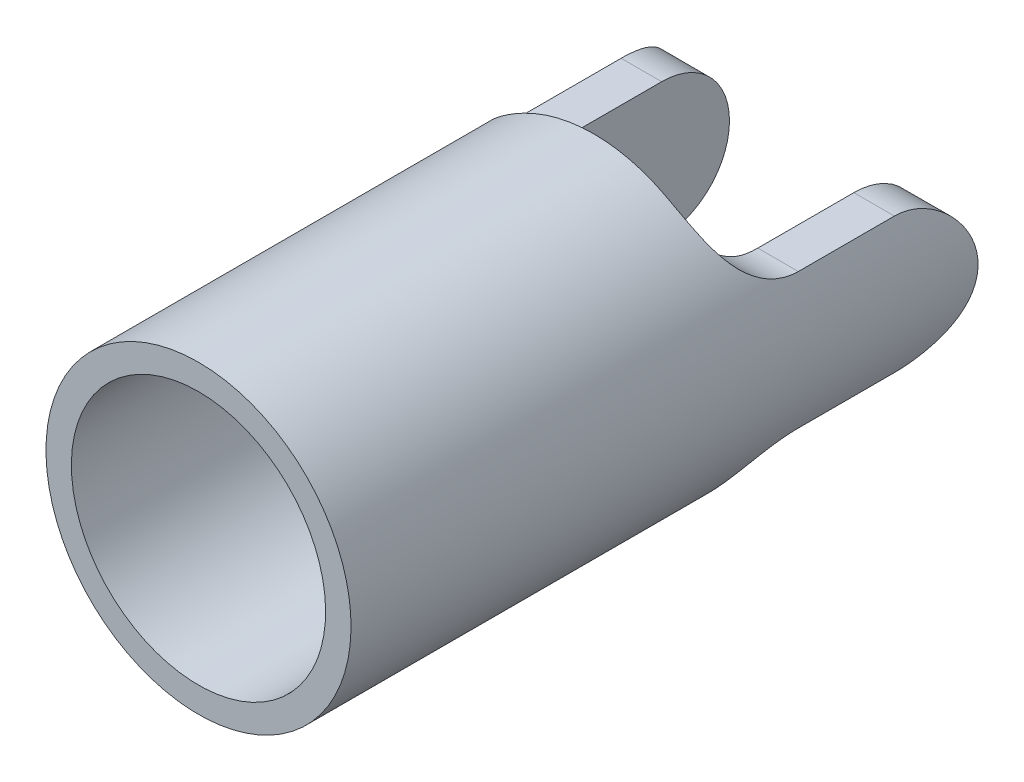
from build123d import *

# Parameters (mm, degrees)
CUT_EXTRUDE1_DEPTH      = 38.432697939
CUT_EXTRUDE1_DEPTH_BACK = 38.432697939
CUT_EXTRUDE2_DEPTH      = 38.432698083
CUT_EXTRUDE2_DEPTH_BACK = 38.432698083


with BuildPart() as part:
    # Sketch1 → Revolve1 (revolve)
    with BuildSketch(Plane(origin=(0, 0, 0), x_dir=(0, 0, -1), z_dir=(1, 0, 0))):
        Polygon((-34.925, 9.525), (-34.925, 7.9375), (-15.925, 7.9375), (-15.925, 0), (9.525, 0), (9.525, 9.525), align=None)
    revolve(axis=Axis((0, 0, 0), (0, 0, 1)))

    # Sketch3 → Cut-Extrude1 (cut, two sides: drawn at the far end of the back side and taken through both)
    with BuildSketch(Plane(origin=(0, 0, 0), x_dir=(0, 0, -1), z_dir=(1, 0, 0)).offset(-CUT_EXTRUDE1_DEPTH_BACK)):
        with BuildLine():
            Line((9.525, 9.525), (-10.233333333, 9.525))
            Line((-10.233333333, 9.525), (-10.233333333, 8.466666667))
            ThreePointArc((-10.233333333, 8.466666667), (-8.993418707, 5.47324796), (-6, 4.233333333))
            Line((-6, 4.233333333), (0, 4.233333333))
            ThreePointArc((0, 4.233333333), (4.233333333, 0), (0, -4.233333333))
            Line((0, -4.233333333), (-6, -4.233333333))
            ThreePointArc((-6, -4.233333333), (-8.993418707, -5.47324796), (-10.233333333, -8.466666667))
            Line((-10.233333333, -8.466666667), (-10.233333333, -9.525))
            Line((-10.233333333, -9.525), (9.525, -9.525))
            Line((9.525, -9.525), (9.525, 9.525))
        make_face()
    extrude(amount=CUT_EXTRUDE1_DEPTH + CUT_EXTRUDE1_DEPTH_BACK, mode=Mode.SUBTRACT)

    # Sketch4 → Cut-Extrude2 (cut, two sides: drawn at the far end of the back side and taken through both)
    with BuildSketch(Plane(origin=(0, 0, 0), x_dir=(1, 0, 0), z_dir=(0, 1, 0)).offset(-CUT_EXTRUDE2_DEPTH_BACK)):
        with BuildLine():
            Line((-2.825, -10.233333333), (2.825, -10.233333333))
            ThreePointArc((2.825, -10.233333333), (5.07006403, -9.303397364), (6, -7.058333333))
            Line((6, -7.058333333), (6, 4.233333333))
            Line((6, 4.233333333), (-6, 4.233333333))
            Line((-6, 4.233333333), (-6, -7.058333333))
            ThreePointArc((-6, -7.058333333), (-5.07006403, -9.303397364), (-2.825, -10.233333333))
        make_face()
    extrude(amount=CUT_EXTRUDE2_DEPTH + CUT_EXTRUDE2_DEPTH_BACK, mode=Mode.SUBTRACT)


solid = part.part
